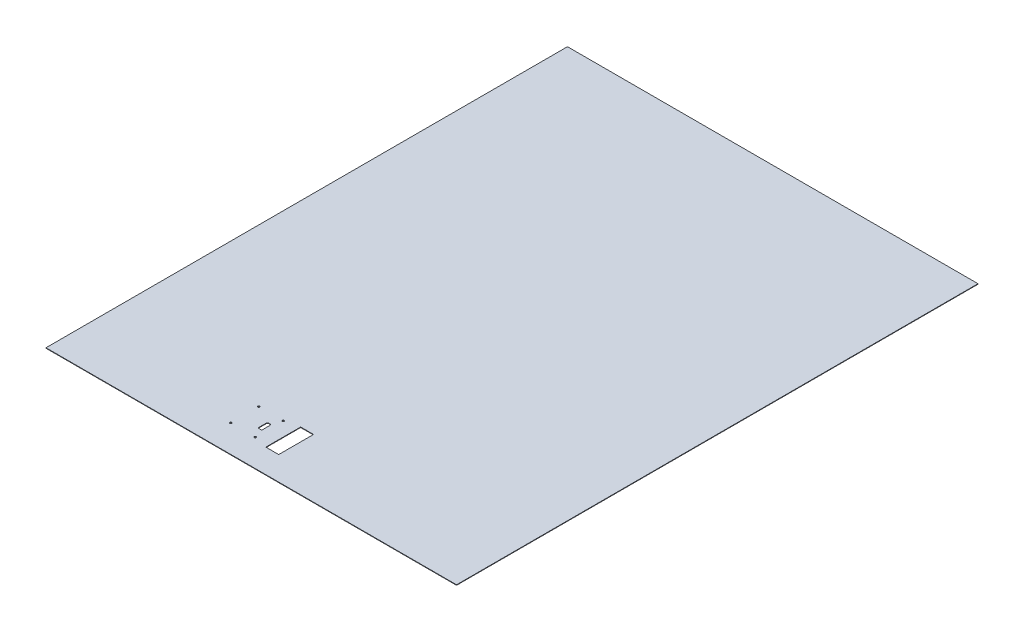
from build123d import *

# Parameters (mm, degrees)
SKETCH1_W           = 860.5
SKETCH1_H           = 1093
BOSS_EXTRUDE1_DEPTH = 1
SKETCH2_W           = 27
SKETCH2_H           = 73
CUT_EXTRUDE1_DEPTH  = 1
SKETCH3_R           = 2
CUT_EXTRUDE2_DEPTH  = 994.422535961
SKETCH4_W           = 8
SKETCH4_H           = 20
CUT_EXTRUDE3_DEPTH  = 1
FILLET1_R           = 2


with BuildPart() as part:
    # Sketch1 → Boss-Extrude1 (new body)
    with BuildSketch(Plane(origin=(0, 0, 0), x_dir=(1, 0, 0), z_dir=(0, 1, 0))):
        with Locations((182.356476286, 235.549001129)):
            Rectangle(SKETCH1_W, SKETCH1_H)
    extrude(amount=BOSS_EXTRUDE1_DEPTH)

    # Sketch2 → Cut-Extrude1 (cut)
    with BuildSketch(Plane(origin=(0, 1, 0), x_dir=(1, 0, 0), z_dir=(0, 1, 0))):
        with Locations((176.356476286, -224.450998871)):
            Rectangle(SKETCH2_W, SKETCH2_H)
    extrude(amount=-CUT_EXTRUDE1_DEPTH, mode=Mode.SUBTRACT)

    # Sketch3 → Cut-Extrude2 (cut, through all)
    with BuildSketch(Plane(origin=(0, 1, 0), x_dir=(1, 0, 0), z_dir=(0, 1, 0))):
        with Locations(Location((133.656476286, -194.950998871, 0), (0, 0, 270))):
            Circle(SKETCH3_R)
        with Locations(Location((133.656476286, -253.950998871, 0), (0, 0, 270))):
            Circle(SKETCH3_R)
        with Locations(Location((81.976476286, -194.950998871, 0), (0, 0, 270))):
            Circle(SKETCH3_R)
        with Locations(Location((81.976476286, -253.950998871, 0), (0, 0, 270))):
            Circle(SKETCH3_R)
    extrude(amount=-CUT_EXTRUDE2_DEPTH, mode=Mode.SUBTRACT)

    # Sketch4 → Cut-Extrude3 (cut)
    with BuildSketch(Plane(origin=(0, 1, 0), x_dir=(1, 0, 0), z_dir=(0, 1, 0))):
        with Locations((123.756476286, -224.450998871)):
            Rectangle(SKETCH4_W, SKETCH4_H)
    extrude(amount=-CUT_EXTRUDE3_DEPTH, mode=Mode.SUBTRACT)

    # Fillet1
    fillet1_edges = [part.edges().sort_by_distance(p)[0] for p in [
        (127.756476286, 0.5, 214.450998871),
        (127.756476286, 0.5, 234.450998871),
        (119.756476286, 0.5, 234.450998871),
        (119.756476286, 0.5, 214.450998871),
    ]]
    fillet(fillet1_edges, radius=FILLET1_R)


solid = part.part
